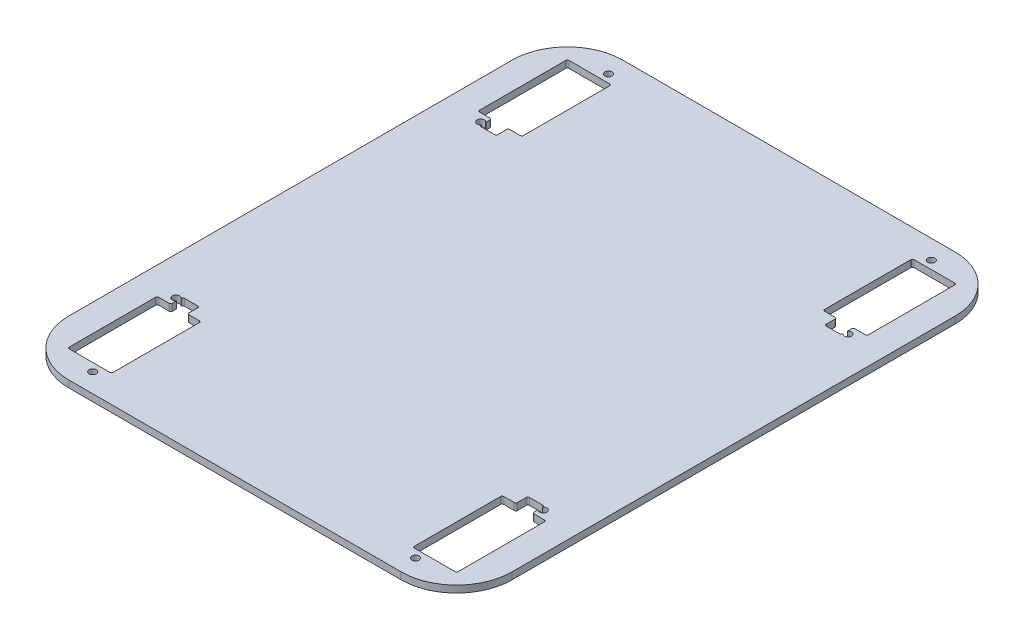
from build123d import *

# Parameters (mm, degrees)
SKETCH1_W             = 203.2
SKETCH1_H             = 254
BOSS_EXTRUDE1_DEPTH   = 3.175
FILLET1_R             = 25.4
CUT_EXTRUDE1_DEPTH    = 25.4
FILLET2_R             = 0.762
M4X0_7_TAPPED_HOLE3_D = 3.3


with BuildPart() as part:
    # Sketch1 → Boss-Extrude1 (new body)
    with BuildSketch(Plane(origin=(0, 0, 0), x_dir=(1, 0, 0), z_dir=(0, 1, 0))):
        Rectangle(SKETCH1_W, SKETCH1_H)
    extrude(amount=BOSS_EXTRUDE1_DEPTH)

    # Fillet1
    fillet1_edges = [part.edges().sort_by_distance(p)[0] for p in [
        (101.6, 1.5875, 127),
        (-101.6, 1.5875, 127),
        (-101.6, 1.5875, -127),
        (101.6, 1.5875, -127),
    ]]
    fillet(fillet1_edges, radius=FILLET1_R)

    # Sketch2 → Cut-Extrude1 (cut)
    with BuildSketch(Plane.XZ):
        Polygon((-69.046, 73.546000013), (-69.046, 114.554000013), (-89.154, 114.554000013), (-89.154, 73.546000013), (-82.904, 73.546000013), (-82.904, 68.046000013), (-75.296, 68.046000013), (-75.296, 73.546000013), align=None)
        Polygon((75.296, 73.546000013), (69.046, 73.546000013), (69.046, 114.554000013), (89.154, 114.554000013), (89.154, 73.546000013), (82.904, 73.546000013), (82.904, 68.046000013), (75.296, 68.046000013), align=None)
        Polygon((69.046, -73.546000013), (69.046, -114.554000013), (89.154, -114.554000013), (89.154, -73.546000013), (82.904, -73.546000013), (82.904, -68.046000013), (75.296, -68.046000013), (75.296, -73.546000013), align=None)
        Polygon((-75.296, -73.546000013), (-69.046, -73.546000013), (-69.046, -114.554000013), (-89.154, -114.554000013), (-89.154, -73.546000013), (-82.904, -73.546000013), (-82.904, -68.046000013), (-75.296, -68.046000013), align=None)
    extrude(amount=-CUT_EXTRUDE1_DEPTH, mode=Mode.SUBTRACT)

    # Fillet2
    fillet2_edges = [part.edges().sort_by_distance(p)[0] for p in [
        (-69.046, 1.5875, 73.546000013),
        (-75.296, 1.5875, 73.546000013),
        (-75.296, 1.5875, 68.046000013),
        (-82.904, 1.5875, 68.046000013),
        (-82.904, 1.5875, 73.546000013),
        (-89.154, 1.5875, 73.546000013),
        (-89.154, 1.5875, 114.554000013),
        (-69.046, 1.5875, 114.554000013),
        (-82.904, 1.5875, -68.046000013),
        (-75.296, 1.5875, -68.046000013),
        (-75.296, 1.5875, -73.546000013),
        (-69.046, 1.5875, -73.546000013),
        (-69.046, 1.5875, -114.554000013),
        (-89.154, 1.5875, -114.554000013),
        (-89.154, 1.5875, -73.546000013),
        (-82.904, 1.5875, -73.546000013),
        (69.046, 1.5875, -73.546000013),
        (75.296, 1.5875, -73.546000013),
        (75.296, 1.5875, -68.046000013),
        (82.904, 1.5875, -68.046000013),
        (82.904, 1.5875, -73.546000013),
        (89.154, 1.5875, -73.546000013),
        (89.154, 1.5875, -114.554000013),
        (69.046, 1.5875, -114.554000013),
        (82.904, 1.5875, 68.046000013),
        (75.296, 1.5875, 68.046000013),
        (75.296, 1.5875, 73.546000013),
        (69.046, 1.5875, 73.546000013),
        (69.046, 1.5875, 114.554000013),
        (89.154, 1.5875, 114.554000013),
        (89.154, 1.5875, 73.546000013),
        (82.904, 1.5875, 73.546000013),
    ]]
    fillet(fillet2_edges, radius=FILLET2_R)

    # M4x0.7 Tapped Hole3 (through all)
    with Locations(Plane(origin=(0, 3.175, 0), x_dir=(1, 0, 0), z_dir=(0, 1, 0))):
        with Locations((-84.2, -69.850000013), (-74, -118.250000013), (74, -118.250000013), (84.2, -69.850000013), (84.2, 69.850000013), (74, 118.250000013), (-74, 118.250000013), (-84.2, 69.850000013)):
            Hole(M4X0_7_TAPPED_HOLE3_D / 2)


solid = part.part
